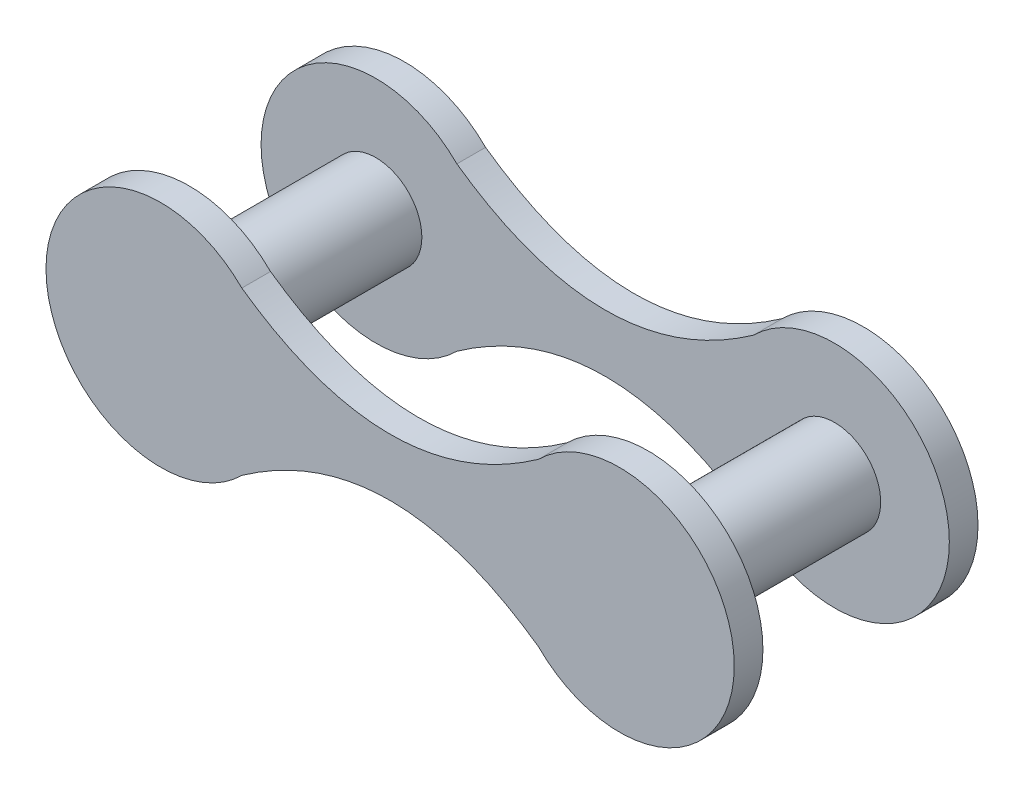
from build123d import *

# Parameters (mm, degrees)
BOSS_EXTRUDE1_DEPTH = 0.79375
SKETCH2_R           = 1.275343429
BOSS_EXTRUDE2_DEPTH = 5.159375


with BuildPart() as part:
    # Sketch1 → Boss-Extrude1 (new body)
    with BuildSketch(Plane.XY):
        with BuildLine():
            ThreePointArc((-4.10493597, 2.24506403), (-9.525, 0), (-4.10493597, -2.24506403))
            add(Edge.make_bspline(
                [(-4.10493597, -2.24506403), (0, 0.65756403), (4.10493597, -2.24506403)],
                knots=[0, 0, 0, 1, 1, 1], degree=2))
            ThreePointArc((4.10493597, -2.24506403), (9.525, 0), (4.10493597, 2.24506403))
            add(Edge.make_bspline(
                [(-4.10493597, 2.24506403), (0, -0.65756403), (4.10493597, 2.24506403)],
                knots=[0, 0, 0, 1, 1, 1], degree=2))
        make_face()
    boss_extrude1 = extrude(amount=BOSS_EXTRUDE1_DEPTH)

    # Sketch2 → Boss-Extrude2 (add)
    with BuildSketch(Plane.XY.offset(0.79375)):
        with Locations((-6.35, 0)):
            Circle(SKETCH2_R)
        with Locations(Location((6.35, 0, 0), (0, 0, 180))):
            Circle(SKETCH2_R)
    extrude(amount=BOSS_EXTRUDE2_DEPTH)

    # Mirror1: Boss-Extrude1 across plane
    add(boss_extrude1.mirror(Plane.XY.offset(3.3734375)))


solid = part.part
